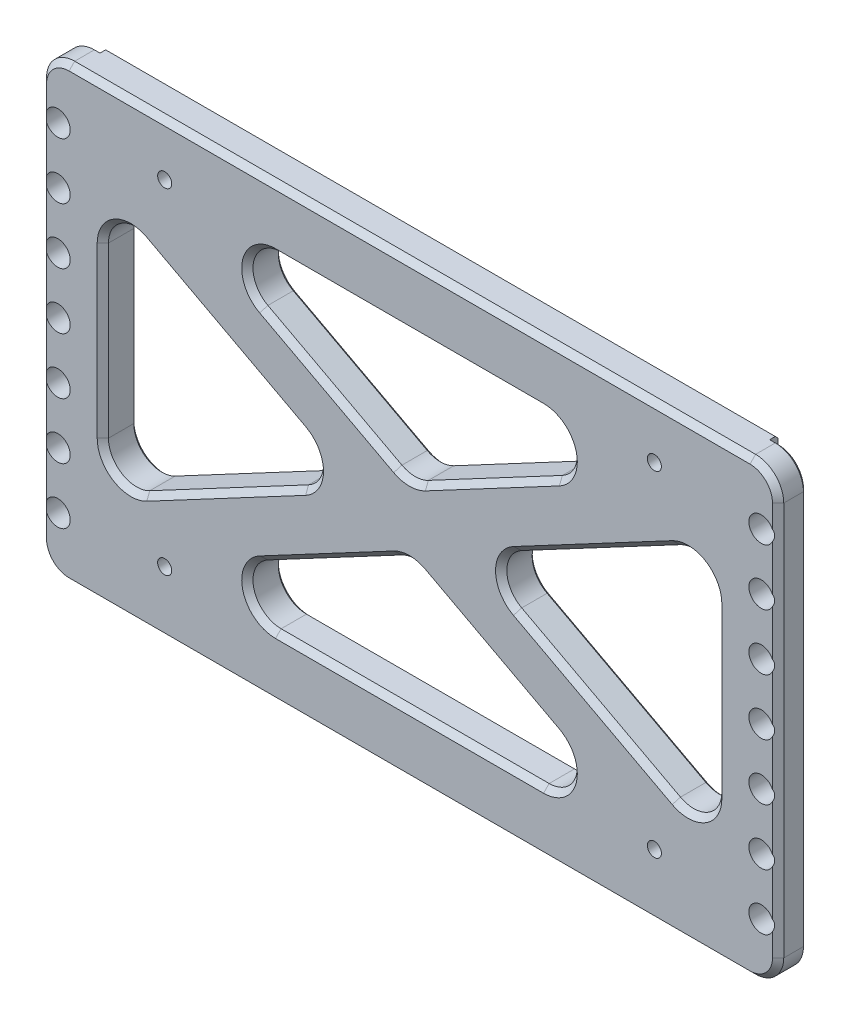
from build123d import *

# Parameters (mm, degrees)
SKETCH_3_W             = 131
SKETCH_3_H             = 80
EXTRUDE_3_DEPTH        = 5
SKETCH_4_W             = 119
SKETCH_4_H             = 80
EXTRUDE_4_DEPTH        = 6
FILLET_2_R             = 5
CHAMFER_1_SIZE         = 1
CUT_EXTRUDE_1_DEPTH    = 6
FILLET_3_R             = 5
CHAMFER_2_SIZE         = 1
SKETCH_6_R             = 2.2
CUT_EXTRUDE_2_DEPTH    = 11
HOLE_WIZARD_M3_1_D     = 2.5
HOLE_WIZARD_M3_1_DEPTH = 7.5
HOLE_WIZARD_M3_1_TIP   = 0.751075774
CHAMFER_3_SIZE         = 0.5


with BuildPart() as part:
    # 草图3 → 凸台-拉伸3 (new body)
    with BuildSketch(Plane.XY):
        with Locations((0, -51.5)):
            Rectangle(SKETCH_3_W, SKETCH_3_H)
    extrude(amount=EXTRUDE_3_DEPTH)

    # 草图4 → 凸台-拉伸4 (add)
    with BuildSketch(Plane.XY.offset(5)):
        with Locations((0, -51.5)):
            Rectangle(SKETCH_4_W, SKETCH_4_H)
    extrude(amount=-EXTRUDE_4_DEPTH)

    # 圆角2
    fillet_2_edges = [part.edges().sort_by_distance(p)[0] for p in [
        (-65.5, -11.5, 2.5),
        (65.5, -11.5, 2.5),
        (65.5, -91.5, 2.5),
        (-65.5, -91.5, 2.5),
    ]]
    fillet(fillet_2_edges, radius=FILLET_2_R)

    # 倒角1
    chamfer_1_edges = [part.edges().sort_by_distance(p)[0] for p in [
        (0, -11.5, 5),
        (65.5, -51.5, 5),
        (0, -91.5, 5),
        (-65.5, -51.5, 5),
        (64.035533906, -90.035533906, 5),
        (-64.035533906, -90.035533906, 5),
        (-64.035533906, -12.964466094, 5),
        (64.035533906, -12.964466094, 5),
    ]]
    chamfer(chamfer_1_edges, length=CHAMFER_1_SIZE)

    # 草图5 → 切除-拉伸1 (cut)
    with BuildSketch(Plane.XY.offset(5)):
        Polygon((-10.644021059, -51.5), (-54.5, -28.163791023), (-54.5, -74.836208978), align=None)
        Polygon((43.855978941, -22.5), (-43.855978941, -22.5), (0, -45.836208978), align=None)
        Polygon((54.5, -28.163791023), (10.644021059, -51.5), (54.5, -74.836208978), align=None)
        Polygon((43.855978941, -80.5), (0, -57.163791023), (-43.855978941, -80.5), align=None)
    extrude(amount=-CUT_EXTRUDE_1_DEPTH, mode=Mode.SUBTRACT)

    # 圆角3
    fillet_3_edges = [part.edges().sort_by_distance(p)[0] for p in [
        (10.644021059, -51.5, 2),
        (54.5, -28.163791023, 2),
        (54.5, -74.836208978, 2),
        (-43.855978941, -22.5, 2),
        (43.855978941, -22.5, 2),
        (0, -45.836208978, 2),
        (-43.855978941, -80.5, 2),
        (0, -57.163791023, 2),
        (43.855978941, -80.5, 2),
        (-54.5, -74.836208978, 2),
        (-54.5, -28.163791023, 2),
        (-10.644021059, -51.5, 2),
    ]]
    fillet(fillet_3_edges, radius=FILLET_3_R)

    # 倒角2
    chamfer_2_edges = [part.edges().sort_by_distance(p)[0] for p in [
        (33.045284631, -39.580061586, 5),
        (54.5, -51.5, 5),
        (33.045284631, -63.419938415, 5),
        (14.256439507, -38.250213644, 5),
        (-14.256439507, -38.250213644, 5),
        (0, -22.5, 5),
        (-33.045284631, -39.580061586, 5),
        (-33.045284631, -63.419938415, 5),
        (-54.5, -51.5, 5),
        (-14.256439507, -64.749786356, 5),
        (14.256439507, -64.749786356, 5),
        (0, -80.5, 5),
        (52.074521107, -32.201893935, 5),
        (52.074521107, -70.798106066, 5),
        (16.288042118, -51.5, 5),
        (0, -45.172417956, 5),
        (-28.666695849, -26.289632976, 5),
        (28.666695849, -26.289632976, 5),
        (-16.288042118, -51.5, 5),
        (-52.074521107, -70.798106066, 5),
        (-52.074521107, -32.201893935, 5),
        (0, -57.827582045, 5),
        (28.666695849, -76.710367025, 5),
        (-28.666695849, -76.710367025, 5),
    ]]
    chamfer(chamfer_2_edges, length=CHAMFER_2_SIZE)

    # 草图6 → 切除-拉伸2 (cut)
    with BuildSketch(Plane.XY.offset(5)):
        with Locations(Location((62.5, -21.5, 0), (0, 0, 24.619977329))):
            Circle(SKETCH_6_R)
        with Locations(Location((62.5, -31.5, 0), (0, 0, 24.619977329))):
            Circle(SKETCH_6_R)
        with Locations(Location((62.5, -41.5, 0), (0, 0, 24.619977329))):
            Circle(SKETCH_6_R)
        with Locations(Location((62.5, -51.5, 0), (0, 0, 24.619977329))):
            Circle(SKETCH_6_R)
        with Locations(Location((62.5, -61.5, 0), (0, 0, 24.619977329))):
            Circle(SKETCH_6_R)
        with Locations(Location((62.5, -71.5, 0), (0, 0, 24.619977329))):
            Circle(SKETCH_6_R)
        with Locations(Location((62.5, -81.5, 0), (0, 0, 335.380022671))):
            Circle(SKETCH_6_R)
    cut_extrude_2 = extrude(amount=-CUT_EXTRUDE_2_DEPTH, mode=Mode.SUBTRACT)

    # 镜向1: 切除-拉伸2 across plane
    add(cut_extrude_2.mirror(Plane(origin=(0, 0, 0), x_dir=(0, 0, 1), z_dir=(1, 0, 0))), mode=Mode.SUBTRACT)

    # M3 螺纹孔1
    with Locations(Plane.XY.offset(5)):
        with Locations((-43.51, -20.75), (43.51, -20.75), (43.51, -80.29), (-43.51, -80.29)):
            Hole(HOLE_WIZARD_M3_1_D / 2, depth=HOLE_WIZARD_M3_1_DEPTH)
            with Locations((0, 0, -(HOLE_WIZARD_M3_1_DEPTH + HOLE_WIZARD_M3_1_TIP / 2))):  # 118° drill point
                Cone(0, HOLE_WIZARD_M3_1_D / 2, HOLE_WIZARD_M3_1_TIP, mode=Mode.SUBTRACT)

    # 倒角3
    chamfer_3_edges = [part.edges().sort_by_distance(p)[0] for p in [
        (33.045284631, -39.580061586, -1),
        (54.5, -51.5, -1),
        (33.045284631, -63.419938415, -1),
        (14.256439507, -38.250213644, -1),
        (-60, -11.5, 0),
        (-14.256439507, -38.250213644, -1),
        (0, -22.5, -1),
        (60, -91.5, 0),
        (-33.045284631, -39.580061586, -1),
        (-33.045284631, -63.419938415, -1),
        (-54.5, -51.5, -1),
        (-14.256439507, -64.749786356, -1),
        (14.256439507, -64.749786356, -1),
        (0, -80.5, -1),
        (52.074521107, -32.201893935, -1),
        (52.074521107, -70.798106066, -1),
        (16.288042118, -51.5, -1),
        (0, -45.172417956, -1),
        (-28.666695849, -26.289632976, -1),
        (28.666695849, -26.289632976, -1),
        (-16.288042118, -51.5, -1),
        (-52.074521107, -70.798106066, -1),
        (-52.074521107, -32.201893935, -1),
        (0, -57.827582045, -1),
        (28.666695849, -76.710367025, -1),
        (-28.666695849, -76.710367025, -1),
        (0, -91.5, -1),
        (0, -11.5, -1),
        (60, -11.5, 0),
        (65.5, -51.5, 0),
        (64.035533906, -90.035533906, 0),
        (64.035533906, -12.964466094, 0),
        (-65.5, -51.5, 0),
        (-60, -91.5, 0),
        (-64.035533906, -90.035533906, 0),
        (-64.035533906, -12.964466094, 0),
    ]]
    chamfer(chamfer_3_edges, length=CHAMFER_3_SIZE)


solid = part.part
